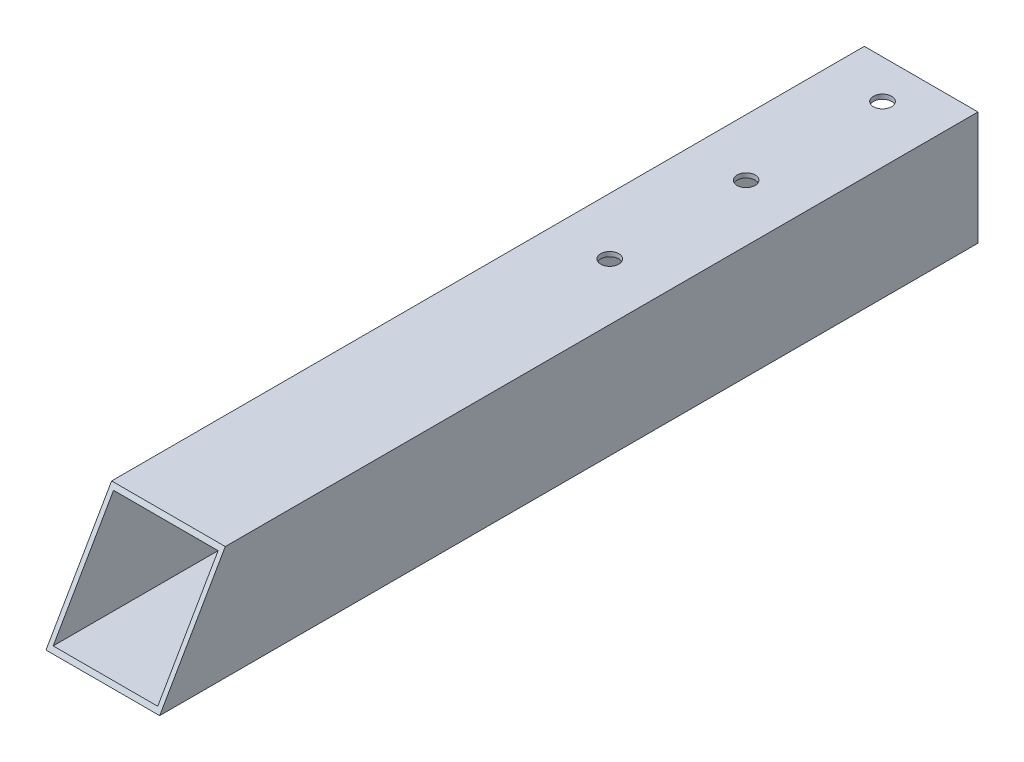
from build123d import *

# Parameters (mm, degrees)
SKETCH1_W           = 25
SKETCH1_H           = 25
SKETCH1_W_2         = 23
SKETCH1_H_2         = 23
BOSS_EXTRUDE1_DEPTH = 180
CUT_EXTRUDE1_DEPTH  = 183.157212319
CUT_EXTRUDE2_REACH  = 184.157
SKETCH3_R           = 2


with BuildPart() as part:
    # Sketch1 → Boss-Extrude1 (new body)
    with BuildSketch(Plane.XY):
        Rectangle(SKETCH1_W, SKETCH1_H)
        Rectangle(SKETCH1_W_2, SKETCH1_H_2, mode=Mode.SUBTRACT)
    extrude(amount=BOSS_EXTRUDE1_DEPTH)

    # Sketch2 → Cut-Extrude1 (cut, through all)
    with BuildSketch(Plane(origin=(12.5, 0, 0), x_dir=(0, 0, -1), z_dir=(1, 0, 0))):
        Polygon((-180, -12.5), (-165.56624327, 12.5), (-180, 12.5), align=None)
    extrude(amount=-CUT_EXTRUDE1_DEPTH, mode=Mode.SUBTRACT)

    # Sketch3 → Cut-Extrude2 (cut, up to next)
    with BuildSketch(Plane(origin=(0, 12.5, 0), x_dir=(1, 0, 0), z_dir=(0, 1, 0)), mode=Mode.PRIVATE) as cut_extrude2_sk1:
        with Locations(Location((0, -8.5, 0), (0, 0, 270))):
            Circle(SKETCH3_R)
    cut_extrude2_tool1 = extrude(cut_extrude2_sk1.sketch, amount=-CUT_EXTRUDE2_REACH, mode=Mode.PRIVATE) & part.part
    # Sketch3 → Cut-Extrude2 (cut, up to next)
    with BuildSketch(Plane(origin=(0, 12.5, 0), x_dir=(1, 0, 0), z_dir=(0, 1, 0)), mode=Mode.PRIVATE) as cut_extrude2_sk2:
        with Locations(Location((0, -38.5, 0), (0, 0, 270))):
            Circle(SKETCH3_R)
    cut_extrude2_tool2 = extrude(cut_extrude2_sk2.sketch, amount=-CUT_EXTRUDE2_REACH, mode=Mode.PRIVATE) & part.part
    # Sketch3 → Cut-Extrude2 (cut, up to next)
    with BuildSketch(Plane(origin=(0, 12.5, 0), x_dir=(1, 0, 0), z_dir=(0, 1, 0)), mode=Mode.PRIVATE) as cut_extrude2_sk3:
        with Locations(Location((0, -68.5, 0), (0, 0, 270))):
            Circle(SKETCH3_R)
    cut_extrude2_tool3 = extrude(cut_extrude2_sk3.sketch, amount=-CUT_EXTRUDE2_REACH, mode=Mode.PRIVATE) & part.part
    add(cut_extrude2_tool1.solids().sort_by_distance((0, 12.5, 8.5))[0], mode=Mode.SUBTRACT)
    add(cut_extrude2_tool2.solids().sort_by_distance((0, 12.5, 38.5))[0], mode=Mode.SUBTRACT)
    add(cut_extrude2_tool3.solids().sort_by_distance((0, 12.5, 68.5))[0], mode=Mode.SUBTRACT)


solid = part.part
